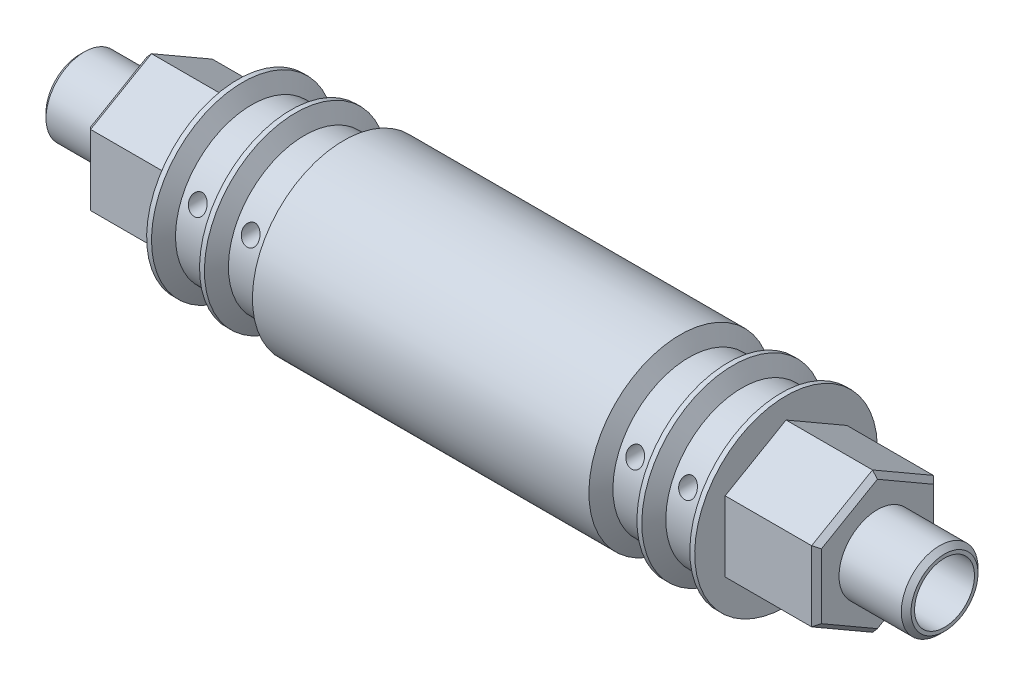
from build123d import *

# Parameters (mm, degrees)
BOSS_EXTRUDE4_DEPTH     = 9.525
CUT_EXTRUDE1_DEPTH      = 48.068686512
CUT_EXTRUDE1_DEPTH_BACK = 48.068686512
SKETCH6_R               = 0.889
CHAMFER2_SIZE           = 0.508
CHAMFER3_SIZE           = 0.508
SKETCH7_R               = 3.124999973
CUT_EXTRUDE2_DEPTH      = 92.200280975


with BuildPart() as part:
    # Sketch1 → Revolve1 (revolve)
    with BuildSketch(Plane.XY, mode=Mode.PRIVATE) as revolve1_sk:
        Polygon((-27.150456448, 7.9375), (-28.067, 9.525), (-28.575, 9.525), (-28.575, 4.254000001), (-38.1, 4.254000001), (-38.1, 4.000000001), (-45.1, 4.000000001), (-45.1, 1.599999975), (-35.275, 1.599999975), (-33.675000025, 0), (-28.575, 0), (0, 0), (0, 9.525), (-17.542825791, 9.525), (-18.459369343, 7.9375), (-21.634369343, 7.9375), (-22.550912895, 9.525), (-23.058912895, 9.525), (-23.975456448, 7.9375), align=None)
    revolve(revolve1_sk.sketch.rotate(Axis((-38.1, 0, 0), (1, 0, 0)), 180), axis=Axis((-38.1, 0, 0), (1, 0, 0)))

    # Sketch4 → Boss-Extrude4 (add)
    with BuildSketch(Plane.ZY.offset(28.575)):
        Polygon((0, 7.332348419), (-6.35, 3.666174209), (-6.35, -3.666174209), (0, -7.332348419), (6.35, -3.666174209), (6.35, 3.666174209), align=None)
    extrude(amount=BOSS_EXTRUDE4_DEPTH)

    # Sketch6 → Cut-Extrude1 (cut, two sides: drawn at the far end of the back side and taken through both)
    with BuildSketch(Plane.XY.offset(-CUT_EXTRUDE1_DEPTH_BACK)):
        with Locations((-25.562956448, 3.302)):
            Circle(SKETCH6_R)
        with Locations((-20.046869343, 3.302)):
            Circle(SKETCH6_R)
    extrude(amount=CUT_EXTRUDE1_DEPTH + CUT_EXTRUDE1_DEPTH_BACK, mode=Mode.SUBTRACT)

    # Chamfer2
    chamfer2_edges = [part.edges().sort_by_distance(p)[0] for p in [
        (-38.1, 0, 6.35),
        (-38.1, -5.499261314, 3.175),
        (-38.1, -5.499261314, -3.175),
        (-38.1, 0, -6.35),
        (-38.1, 5.499261314, -3.175),
        (-38.1, 5.499261314, 3.175),
    ]]
    chamfer(chamfer2_edges, length=CHAMFER2_SIZE)

    # Chamfer3
    chamfer3_edges = [part.edges().sort_by_distance(p)[0] for p in [
        (-45.1, 4.000000001, 0),
    ]]
    chamfer(chamfer3_edges, length=CHAMFER3_SIZE)

    # Mirror2: part across plane


with BuildPart() as part_1:
    add(part.part)
    add(part.part.mirror(Plane(origin=(0, 0, 0), x_dir=(0, 0, 1), z_dir=(1, 0, 0))))

    # Sketch7 → Cut-Extrude2 (cut, through all)
    with BuildSketch(Plane.ZY.offset(45.1)):
        with Locations(Location((0, 0, 0), (0, 0, 270))):
            Circle(SKETCH7_R)
    extrude(amount=-CUT_EXTRUDE2_DEPTH, mode=Mode.SUBTRACT)


solid = part_1.part
